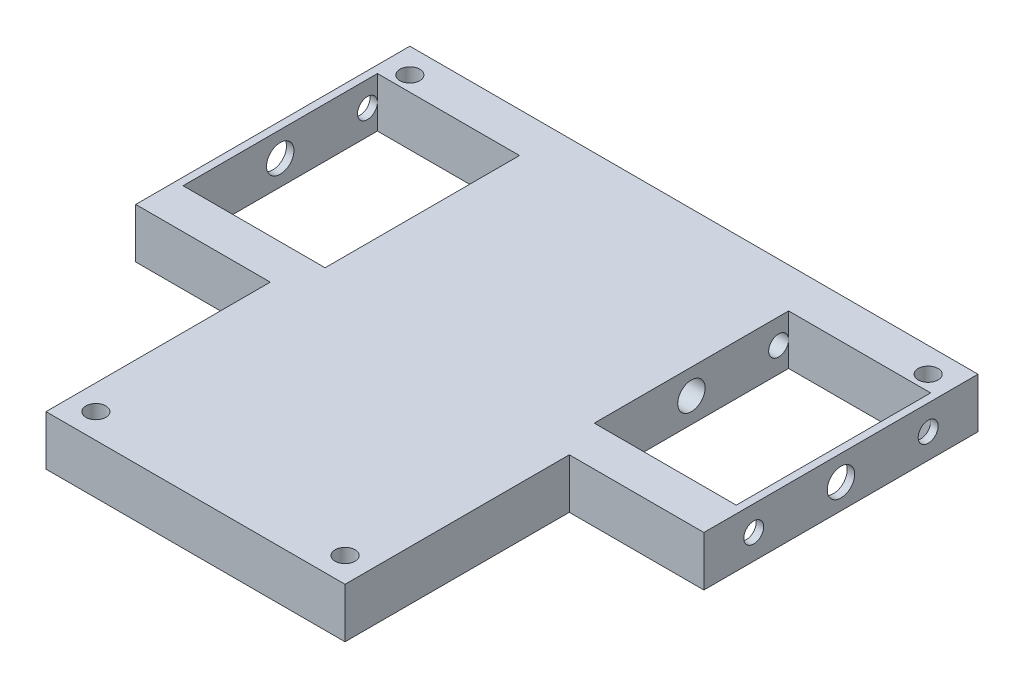
from build123d import *

# Parameters (mm, degrees)
BOSS_EXTRUDE1_DEPTH     = 10
CUT_EXTRUDE1_DEPTH      = 116.537872579
CUT_EXTRUDE1_DEPTH_BACK = 116.537872579
SKETCH2_R               = 2
SKETCH2_W               = 28.5
SKETCH2_H               = 39
SKETCH5_R               = 2
SKETCH5_R_2             = 2.75
CUT_EXTRUDE2_DEPTH      = 152.973681932


with BuildPart() as part:
    # Sketch1 → Boss-Extrude1 (new body)
    with BuildSketch(Plane(origin=(0, 0, 0), x_dir=(1, 0, 0), z_dir=(0, 1, 0))):
        Polygon((30, 0), (-30, 0), (-30, 45), (-57, 45), (-57, 100), (57, 100), (57, 45), (30, 45), align=None)
    extrude(amount=BOSS_EXTRUDE1_DEPTH)

    # Sketch2 → Cut-Extrude1 (cut, two sides: drawn at the far end of the back side and taken through both)
    with BuildSketch(Plane(origin=(0, 10, 0), x_dir=(1, 0, 0), z_dir=(0, 1, 0)).offset(-CUT_EXTRUDE1_DEPTH_BACK)):
        with Locations(Location((-52, 95, 0), (0, 0, 270))):
            Circle(SKETCH2_R)
        with Locations(Location((52, 95, 0), (0, 0, 270))):
            Circle(SKETCH2_R)
        with Locations(Location((-25, 5, 0), (0, 0, 270))):
            Circle(SKETCH2_R)
        with Locations(Location((25, 5, 0), (0, 0, 270))):
            Circle(SKETCH2_R)
        with Locations((-41.25, 72.5)):
            Rectangle(SKETCH2_W, SKETCH2_H)
        with Locations((41.25, 72.5)):
            Rectangle(SKETCH2_W, SKETCH2_H)
    extrude(amount=CUT_EXTRUDE1_DEPTH + CUT_EXTRUDE1_DEPTH_BACK, mode=Mode.SUBTRACT)

    # Sketch5 → Cut-Extrude2 (cut, through all)
    with BuildSketch(Plane(origin=(57, 0, 0), x_dir=(0, 0, -1), z_dir=(1, 0, 0))):
        with Locations(Location((55, 5, 0), (0, 0, 180))):
            Circle(SKETCH5_R)
        with Locations((90, 5)):
            Circle(SKETCH5_R)
        with Locations(Location((72.5, 5, 0), (0, 0, 180))):
            Circle(SKETCH5_R_2)
    extrude(amount=-CUT_EXTRUDE2_DEPTH, mode=Mode.SUBTRACT)


solid = part.part
